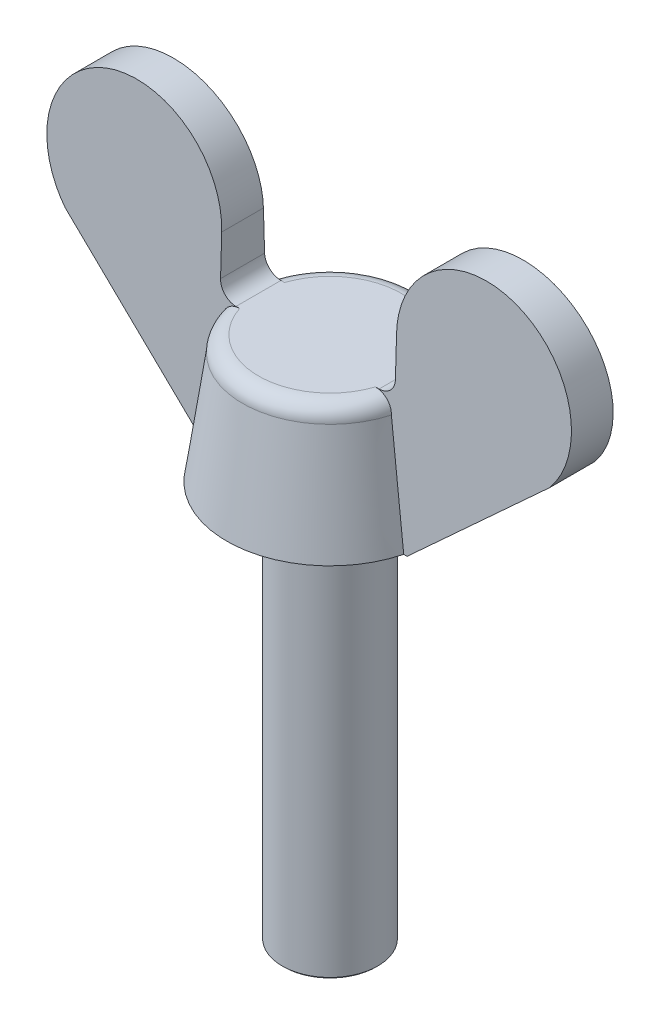
from build123d import *

# Parameters (mm, degrees)
BOSS_EXTRUDE1_DEPTH      = 1.65
BOSS_EXTRUDE1_DEPTH_BACK = 1.65
CUT_EXTRUDE2_DEPTH       = 81
CUT_EXTRUDE2_DEPTH_BACK  = 103


with BuildPart() as part:
    # Sketch1 → Boss-Extrude1 (new, two sides: drawn at the far end of the back side and taken through both)
    with BuildSketch(Plane.XY.offset(-BOSS_EXTRUDE1_DEPTH_BACK)):
        with BuildLine():
            Line((-6.5, 0), (-15.242640687, 8))
            ThreePointArc((-15.242640687, 8), (-12.859499425, 16.676124215), (-5.5, 11.5))
            Line((-5.5, 11.5), (-5.5, 9))
            ThreePointArc((-5.5, 9), (-5.207106781, 8.292893219), (-4.5, 8))
            Line((-4.5, 8), (4.5, 8))
            ThreePointArc((4.5, 8), (5.207106781, 8.292893219), (5.5, 9))
            Line((5.5, 9), (5.5, 11.5))
            ThreePointArc((5.5, 11.5), (12.859499425, 16.676124215), (15.242640687, 8))
            Line((15.242640687, 8), (6.5, 0))
            Line((6.5, 0), (-6.5, 0))
        make_face()
    extrude(amount=BOSS_EXTRUDE1_DEPTH + BOSS_EXTRUDE1_DEPTH_BACK)

    # Sketch6 → Cut-Extrude2 (cut, two sides: drawn at the far end of the back side and taken through both)
    with BuildSketch(Plane(origin=(0, 0, 0), x_dir=(0, 0, -1), z_dir=(1, 0, 0)).offset(-CUT_EXTRUDE2_DEPTH_BACK)):
        Polygon((-3, 0), (-1.65, 0), (-1.15, 17), (-3, 17), align=None)
        Polygon((1.15, 17), (3, 17), (3, 0), (1.65, 0), align=None)
    extrude(amount=CUT_EXTRUDE2_DEPTH + CUT_EXTRUDE2_DEPTH_BACK, mode=Mode.SUBTRACT)

    # Sketch2 → Revolve1 (revolve)
    with BuildSketch(Plane(origin=(0, 0, 0), x_dir=(0, 0, -1), z_dir=(1, 0, 0))):
        with BuildLine():
            Line((0, 0), (-6.5, 0))
            Line((-6.5, 0), (-5.5, 7))
            ThreePointArc((-5.5, 7), (-5.207106781, 7.707106781), (-4.5, 8))
            Line((-4.5, 8), (0, 8))
            Line((0, 8), (0, 0))
        make_face()
    revolve(axis=Axis((0, 0, 0), (0, 1, 0)))

    # Sketch7 → Revolve2 (revolve)
    with BuildSketch(Plane(origin=(0, 0, 0), x_dir=(0, 0, -1), z_dir=(1, 0, 0))):
        Polygon((0, -25), (-2.9, -25), (-3, -24.9), (-3, 0), (0, 0), align=None)
    revolve(axis=Axis((0, 0, 0), (0, -1, 0)))


solid = part.part
